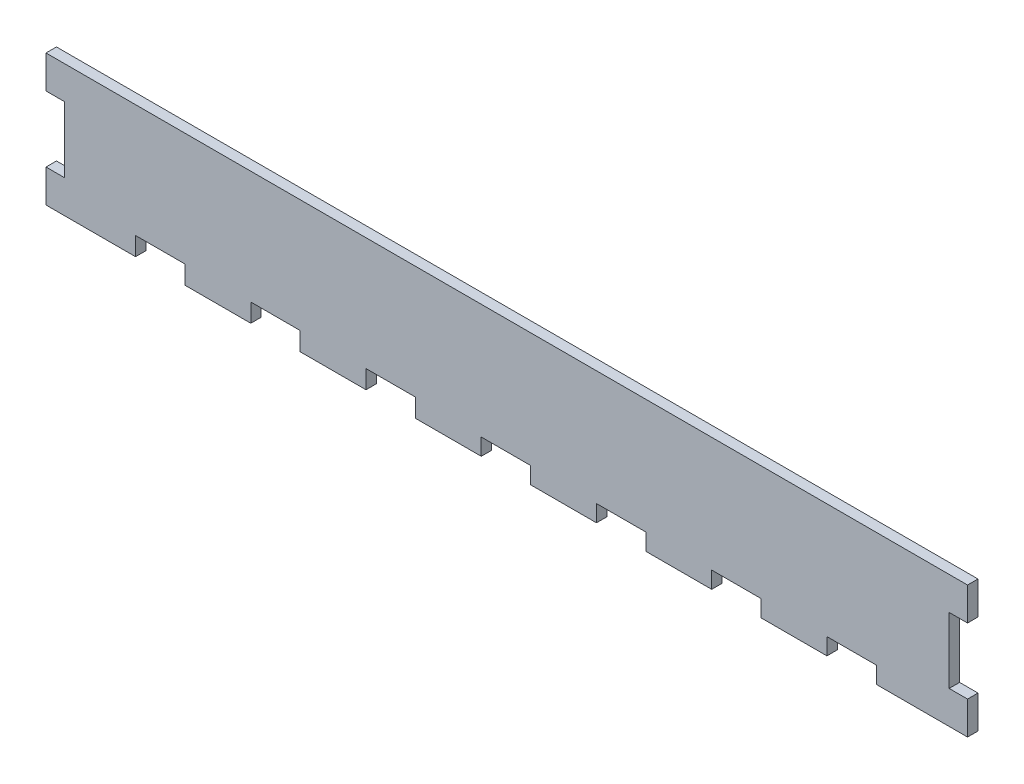
from build123d import *

# Parameters (mm, degrees)
BOSS_EXTRUDE1_DEPTH = 3.175


with BuildPart() as part:
    # Sketch27 → Boss-Extrude1 (new body)
    with BuildSketch(Plane.XY):
        Polygon((-5.330680513, -226.481953179), (274.577319487, -226.481953179), (274.577319487, -236.481953179), (268.989319487, -236.481953179), (268.989319487, -256.481953179), (274.577319487, -256.481953179), (274.577319487, -266.481953179), (246.86524849, -266.481953179), (246.86524849, -261.401953179), (231.865262651, -261.401953179), (231.865262651, -266.481953179), (211.869319487, -266.481953179), (211.869319487, -261.401953179), (196.869319487, -261.401953179), (196.869319487, -266.481953179), (176.865314578, -266.481953179), (176.865314578, -261.401953179), (161.865328739, -261.401953179), (161.865328739, -266.481953179), (141.865347621, -266.481953179), (141.865347621, -261.401953179), (126.869319487, -261.401953179), (126.869319487, -266.481953179), (106.873310236, -266.481953179), (106.873310236, -260.893953179), (91.869319487, -260.893953179), (91.869319487, -266.481953179), (71.869319487, -266.481953179), (71.869319487, -260.893953179), (56.873357441, -260.893953179), (56.873357441, -266.481953179), (36.869319488, -266.481953179), (36.869319488, -260.893953179), (21.869319488, -260.893953179), (21.869319488, -266.481953179), (-5.330680513, -266.481953179), (-5.330680513, -256.481953179), (0.257319487, -256.481953179), (0.257319487, -236.481953179), (-5.330680513, -236.481953179), align=None)
    extrude(amount=BOSS_EXTRUDE1_DEPTH)


solid = part.part
